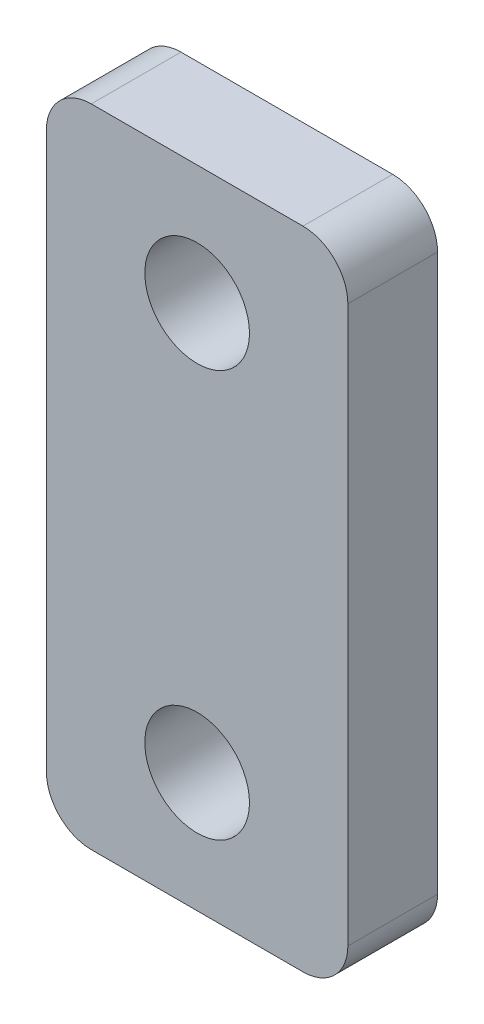
from build123d import *

# Parameters (mm, degrees)
SKETCH1_R           = 3.5
BOSS_EXTRUDE1_DEPTH = 3


with BuildPart() as part:
    # Sketch1 → Boss-Extrude1 (new, symmetric)
    with BuildSketch(Plane.XY):
        with BuildLine():
            Line((-7.079830729, -21.599637276), (7.079830729, -21.599637276))
            ThreePointArc((7.079830729, -21.599637276), (9.201151073, -20.72095762), (10.079830729, -18.599637276))
            Line((10.079830729, -18.599637276), (10.079830729, 18.599637276))
            ThreePointArc((10.079830729, 18.599637276), (9.201151073, 20.72095762), (7.079830729, 21.599637276))
            Line((7.079830729, 21.599637276), (-7.079830729, 21.599637276))
            ThreePointArc((-7.079830729, 21.599637276), (-9.201151073, 20.72095762), (-10.079830729, 18.599637276))
            Line((-10.079830729, 18.599637276), (-10.079830729, -18.599637276))
            ThreePointArc((-10.079830729, -18.599637276), (-9.201151073, -20.72095762), (-7.079830729, -21.599637276))
        make_face()
        with Locations((0, 13.599637276)):
            Circle(SKETCH1_R, mode=Mode.SUBTRACT)
        with Locations((0, -13.599637276)):
            Circle(SKETCH1_R, mode=Mode.SUBTRACT)
    extrude(amount=BOSS_EXTRUDE1_DEPTH, both=True)


solid = part.part
